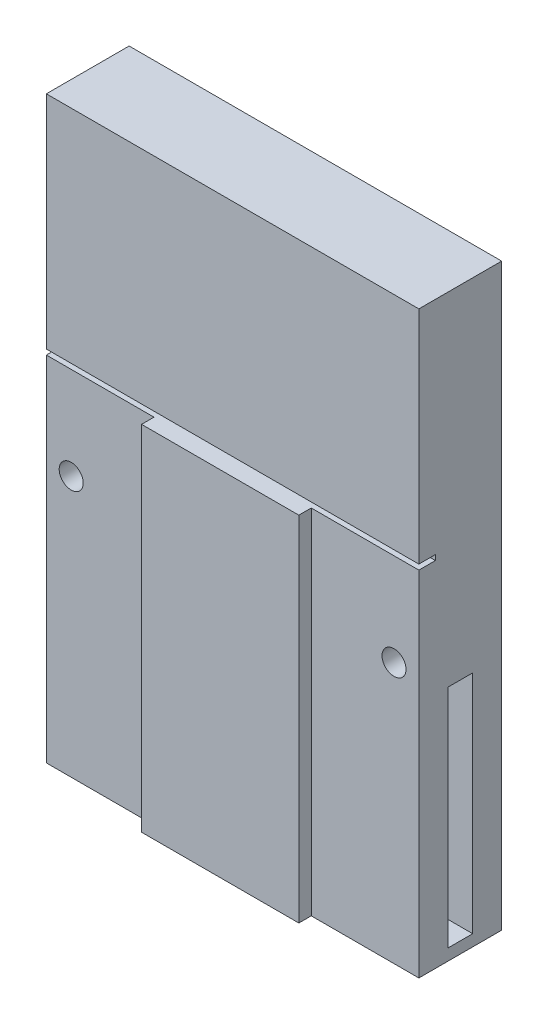
from build123d import *

# Parameters (mm, degrees)
SKETCH2_W           = 45
SKETCH2_H           = 10
BOSS_EXTRUDE1_DEPTH = 40
SKETCH4_W           = 45
SKETCH4_H           = 10
BOSS_EXTRUDE2_DEPTH = 10
SKETCH8_W           = 45
SKETCH8_H           = 10
BOSS_EXTRUDE3_DEPTH = 20
SKETCH9_R           = 1.45
CUT_EXTRUDE2_DEPTH  = 20
SKETCH10_W          = 45
SKETCH10_H          = 0.626165357
CUT_EXTRUDE3_DEPTH  = 2
SKETCH11_W          = 19
SKETCH11_H          = 42.671327575
BOSS_EXTRUDE4_DEPTH = 1.5
SKETCH12_W          = 3
SKETCH12_H          = 27.286335608
CUT_EXTRUDE6_DEPTH  = 10


with BuildPart() as part:
    # Sketch2 → Boss-Extrude1 (new body)
    with BuildSketch(Plane(origin=(0, 0, 0), x_dir=(1, 0, 0), z_dir=(0, 1, 0))):
        Rectangle(SKETCH2_W, SKETCH2_H)
    extrude(amount=BOSS_EXTRUDE1_DEPTH)

    # Sketch4 → Boss-Extrude2 (add)
    with BuildSketch(Plane(origin=(0, 40, 0), x_dir=(1, 0, 0), z_dir=(0, 1, 0))):
        Rectangle(SKETCH4_W, SKETCH4_H)
    extrude(amount=BOSS_EXTRUDE2_DEPTH)

    # Sketch8 → Boss-Extrude3 (add)
    with BuildSketch(Plane.XZ):
        Rectangle(SKETCH8_W, SKETCH8_H)
    extrude(amount=BOSS_EXTRUDE3_DEPTH)

    # Sketch9 → Cut-Extrude2 (cut)
    with BuildSketch(Plane.XY.offset(5)):
        with Locations((19.5, 11.5)):
            Circle(SKETCH9_R)
        with Locations((-19.5, 11.5)):
            Circle(SKETCH9_R)
    extrude(amount=-CUT_EXTRUDE2_DEPTH, mode=Mode.SUBTRACT)

    # Sketch10 → Cut-Extrude3 (cut)
    with BuildSketch(Plane.XY.offset(5)):
        with Locations((0, 22.984410254)):
            Rectangle(SKETCH10_W, SKETCH10_H)
    extrude(amount=-CUT_EXTRUDE3_DEPTH, mode=Mode.SUBTRACT)

    # Sketch11 → Boss-Extrude4 (add)
    with BuildSketch(Plane.XY.offset(5)):
        with Locations((0, 1.335663788)):
            Rectangle(SKETCH11_W, SKETCH11_H)
    extrude(amount=BOSS_EXTRUDE4_DEPTH)

    # Sketch12 → Cut-Extrude6 (cut)
    with BuildSketch(Plane(origin=(22.5, 0, 0), x_dir=(0, 0, -1), z_dir=(1, 0, 0))):
        with Locations((0, -4.971840229)):
            Rectangle(SKETCH12_W, SKETCH12_H)
    cut_extrude6 = extrude(amount=-CUT_EXTRUDE6_DEPTH, mode=Mode.SUBTRACT)

    # Mirror1: Cut-Extrude6 across plane
    add(cut_extrude6.mirror(Plane(origin=(0, 0, 0), x_dir=(0, 0, 1), z_dir=(1, 0, 0))), mode=Mode.SUBTRACT)


solid = part.part
